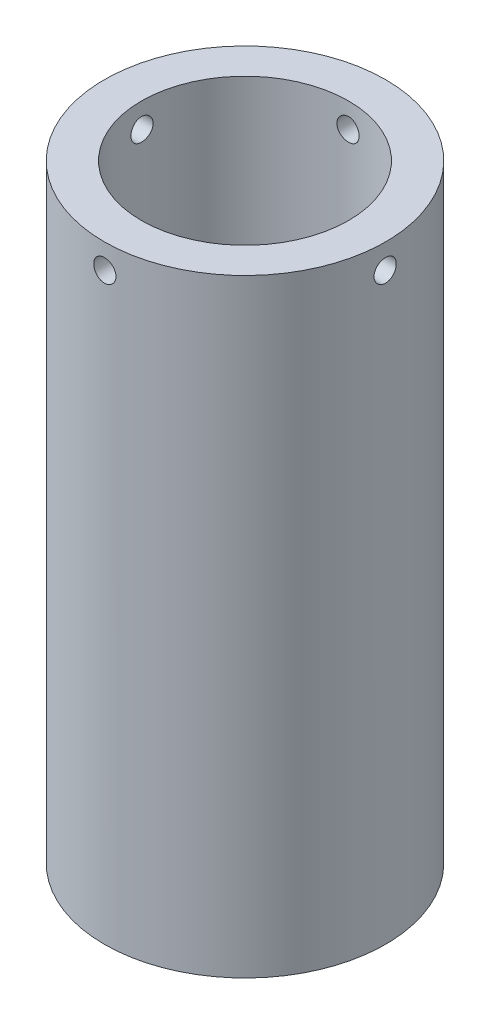
from build123d import *

# Parameters (mm, degrees)
SKETCH1_R           = 28.5
SKETCH1_R_2         = 21
BOSS_EXTRUDE1_DEPTH = 61.675
SKETCH2_R           = 2.25
CUT_EXTRUDE1_DEPTH  = 74.677035941
CIRPATTERN1_COUNT   = 4
SKETCH3_R           = 2.25
CUT_EXTRUDE2_DEPTH  = 6.5


with BuildPart() as part:
    # Sketch1 → Boss-Extrude1 (new, symmetric)
    with BuildSketch(Plane(origin=(0, 0, 0), x_dir=(1, 0, 0), z_dir=(0, 1, 0))):
        with Locations(Location((0, 0, 0), (0, 0, 270))):
            Circle(SKETCH1_R)
        with Locations(Location((0, 0, 0), (0, 0, 270))):
            Circle(SKETCH1_R_2, mode=Mode.SUBTRACT)
    extrude(amount=BOSS_EXTRUDE1_DEPTH, both=True)

    # Sketch2 → Cut-Extrude1 (cut, through all)
    with BuildSketch(Plane.XY):
        with Locations(Location((0, 56.675, 0), (0, 0, 90))):
            Circle(SKETCH2_R)
    cut_extrude1 = extrude(amount=-CUT_EXTRUDE1_DEPTH, mode=Mode.SUBTRACT)

    # CirPattern1: Cut-Extrude1 ×4 about axis
    cirpattern1_axis = Axis((0, 61.675, 0), (0, -1, 0))
    for i in range(1, CIRPATTERN1_COUNT):
        add(cut_extrude1.rotate(cirpattern1_axis, i * 360 / CIRPATTERN1_COUNT), mode=Mode.SUBTRACT)

    # Sketch3 → Cut-Extrude2 (cut)
    with BuildSketch(Plane.XZ.offset(61.675)):
        with Locations(Location((0, 24.75, 0), (0, 0, 270))):
            Circle(SKETCH3_R)
        with Locations(Location((24.75, 0, 0), (0, 0, 270))):
            Circle(SKETCH3_R)
        with Locations(Location((0, -24.75, 0), (0, 0, 270))):
            Circle(SKETCH3_R)
        with Locations(Location((-24.75, 0, 0), (0, 0, 270))):
            Circle(SKETCH3_R)
    extrude(amount=-CUT_EXTRUDE2_DEPTH, mode=Mode.SUBTRACT)


solid = part.part
